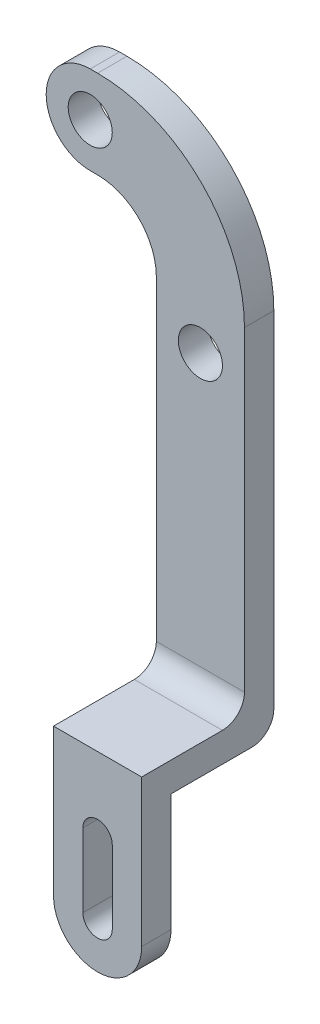
from build123d import *

# Parameters (mm, degrees)
SKETCH1_R           = 3
BOSS_EXTRUDE1_DEPTH = 4
BOSS_EXTRUDE2_DEPTH = 14
CUT_EXTRUDE1_DEPTH  = 14
FILLET1_R           = 3


with BuildPart() as part:
    # Sketch1 → Boss-Extrude1 (new body)
    with BuildSketch(Plane.XY):
        with BuildLine():
            Line((-96.672208827, 8.599646064), (-96.672208827, 74.599646064))
            ThreePointArc((-96.672208827, 74.599646064), (-99.015354577, 80.256500313), (-104.672208827, 82.599646064))
            Line((-104.672208827, 82.599646064), (-105.672208827, 82.599646064))
            ThreePointArc((-105.672208827, 82.599646064), (-111.672208827, 88.599646064), (-105.672208827, 94.599646064))
            Line((-105.672208827, 94.599646064), (-104.672208827, 94.599646064))
            ThreePointArc((-104.672208827, 94.599646064), (-90.530073203, 88.741781688), (-84.672208827, 74.599646064))
            Line((-84.672208827, 74.599646064), (-84.672208827, 8.599646064))
            ThreePointArc((-84.672208827, 8.599646064), (-90.672208827, 2.599646064), (-96.672208827, 8.599646064))
        make_face()
        with Locations((-90.672208827, 68.599646064)):
            Circle(SKETCH1_R, mode=Mode.SUBTRACT)
        with Locations((-105.672208827, 88.599646064)):
            Circle(SKETCH1_R, mode=Mode.SUBTRACT)
        with BuildLine():
            Line((-92.672208827, 8.599646064), (-92.672208827, 18.599646064))
            ThreePointArc((-92.672208827, 18.599646064), (-90.672208827, 20.599646064), (-88.672208827, 18.599646064))
            Line((-88.672208827, 18.599646064), (-88.672208827, 8.599646064))
            ThreePointArc((-88.672208827, 8.599646064), (-90.672208827, 6.599646064), (-92.672208827, 8.599646064))
        make_face(mode=Mode.SUBTRACT)
    extrude(amount=BOSS_EXTRUDE1_DEPTH)

    # Sketch2 → Boss-Extrude2 (add)
    with BuildSketch(Plane(origin=(0, 0, 4), x_dir=(-1, 0, 0), z_dir=(0, 0, -1))):
        with BuildLine():
            Line((84.672208827, 28.599646064), (96.672208827, 28.599646064))
            Line((96.672208827, 28.599646064), (96.672208827, 8.599646064))
            ThreePointArc((96.672208827, 8.599646064), (90.672208827, 2.599646064), (84.672208827, 8.599646064))
            Line((84.672208827, 8.599646064), (84.672208827, 28.599646064))
        make_face()
        with BuildLine():
            Line((88.672208827, 8.599646064), (88.672208827, 18.599646064))
            ThreePointArc((88.672208827, 18.599646064), (90.672208827, 20.599646064), (92.672208827, 18.599646064))
            Line((92.672208827, 18.599646064), (92.672208827, 8.599646064))
            ThreePointArc((92.672208827, 8.599646064), (90.672208827, 6.599646064), (88.672208827, 8.599646064))
        make_face(mode=Mode.SUBTRACT)
    extrude(amount=-BOSS_EXTRUDE2_DEPTH)

    # Sketch3 → Cut-Extrude1 (cut)
    with BuildSketch(Plane(origin=(0, 0, 0), x_dir=(-1, 0, 0), z_dir=(0, 0, -1))):
        with BuildLine():
            Line((84.672208827, 8.599646064), (84.672208827, 24.599646064))
            Line((84.672208827, 24.599646064), (96.672208827, 24.599646064))
            Line((96.672208827, 24.599646064), (96.672208827, 8.599646064))
            ThreePointArc((96.672208827, 8.599646064), (90.672208827, 2.599646064), (84.672208827, 8.599646064))
        make_face()
        with BuildLine():
            Line((88.672208827, 8.599646064), (88.672208827, 18.599646064))
            ThreePointArc((88.672208827, 18.599646064), (90.672208827, 20.599646064), (92.672208827, 18.599646064))
            Line((92.672208827, 18.599646064), (92.672208827, 8.599646064))
            ThreePointArc((92.672208827, 8.599646064), (90.672208827, 6.599646064), (88.672208827, 8.599646064))
        make_face(mode=Mode.SUBTRACT)
    extrude(amount=-CUT_EXTRUDE1_DEPTH, mode=Mode.SUBTRACT)

    # Fillet1
    fillet1_edges = [part.edges().sort_by_distance(p)[0] for p in [
        (-90.672208827, 28.599646064, 4),
        (-90.672208827, 24.599646064, 0),
    ]]
    fillet(fillet1_edges, radius=FILLET1_R)


solid = part.part
